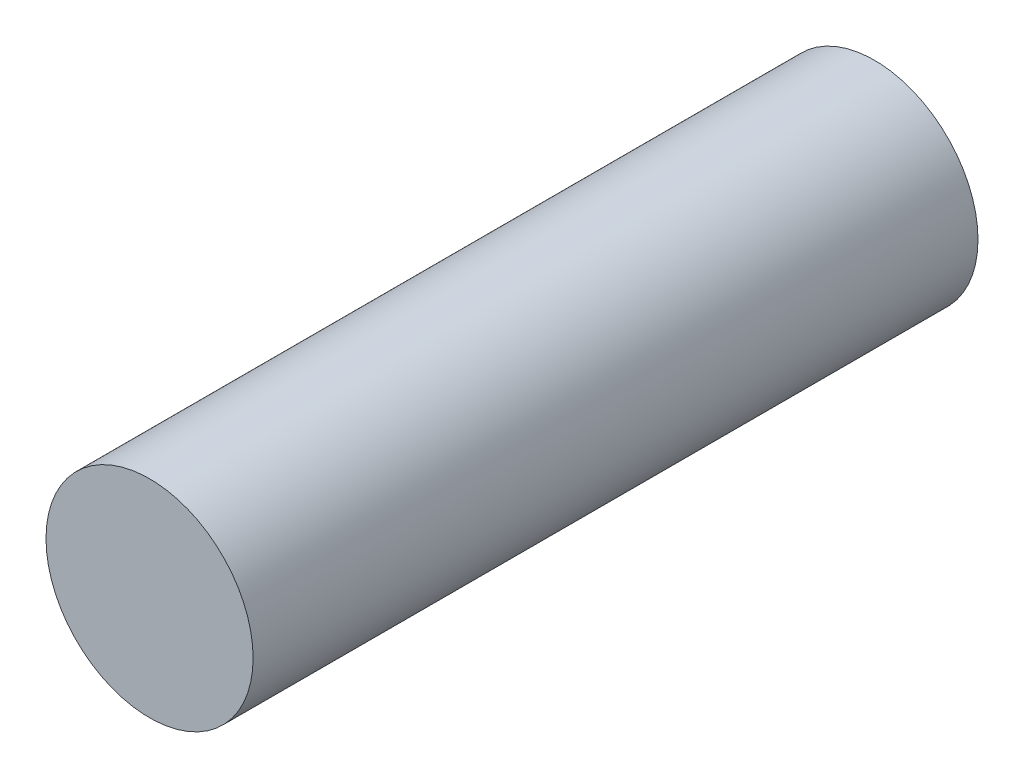
from build123d import *

# Parameters (mm, degrees)
SKETCH1_R           = 38.1
BOSS_EXTRUDE1_DEPTH = 133.35


with BuildPart() as part:
    # Sketch1 → Boss-Extrude1 (new, symmetric)
    with BuildSketch(Plane.XY):
        Circle(SKETCH1_R)
    extrude(amount=BOSS_EXTRUDE1_DEPTH, both=True)


solid = part.part
